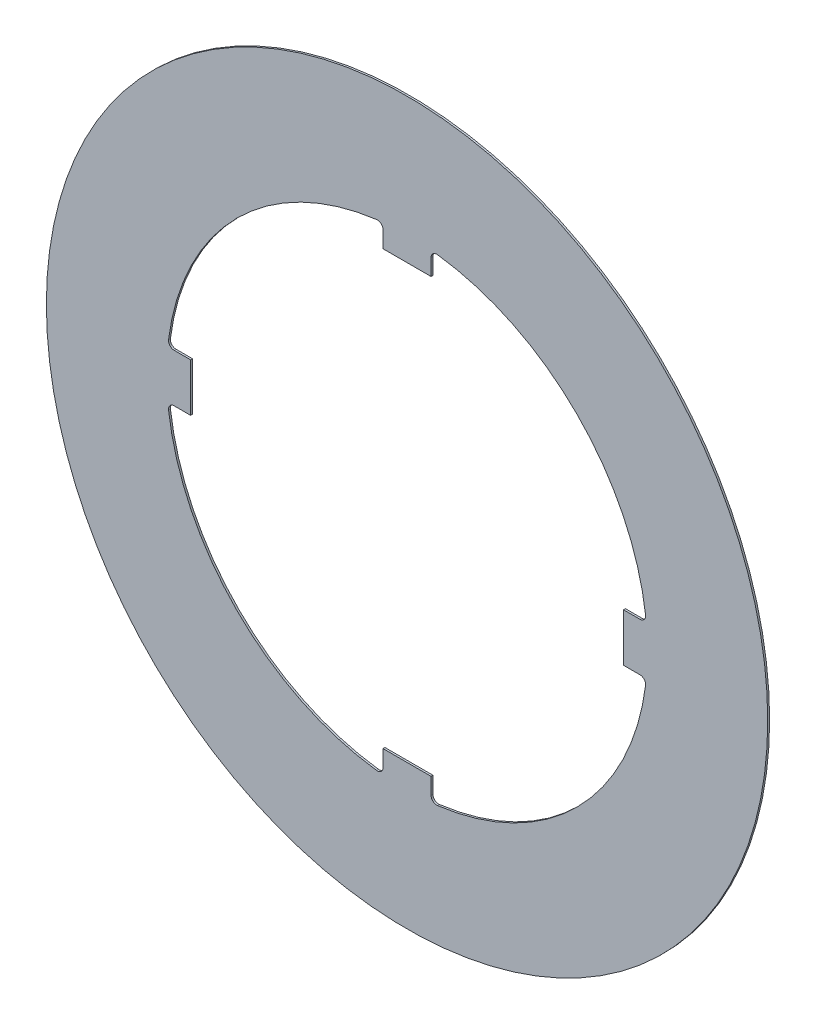
from build123d import *

# Parameters (mm, degrees)
SKETCH1_R           = 1905
BOSS_EXTRUDE1_DEPTH = 5


with BuildPart() as part:
    # Sketch1 → Boss-Extrude1 (new, symmetric)
    with BuildSketch(Plane.XY):
        Circle(SKETCH1_R)
        with BuildLine():
            ThreePointArc((160.798387097, -1259.779297618), (898.025612107, -898.025612107), (1259.779297618, -160.798387097))
            ThreePointArc((1259.779297618, -160.798387097), (1252.536854788, -137.175162206), (1230.020731533, -127))
            Line((1230.020731533, -127), (1143, -127))
            Line((1143, -127), (1143, 127))
            Line((1143, 127), (1230.020731533, 127))
            ThreePointArc((1230.020731533, 127), (1252.536854788, 137.175162206), (1259.779297618, 160.798387097))
            ThreePointArc((1259.779297618, 160.798387097), (898.025612107, 898.025612107), (160.798387097, 1259.779297618))
            ThreePointArc((160.798387097, 1259.779297618), (137.175162206, 1252.536854788), (127, 1230.020731533))
            Line((127, 1230.020731533), (127, 1143))
            Line((127, 1143), (-127, 1143))
            Line((-127, 1143), (-127, 1230.020731533))
            ThreePointArc((-127, 1230.020731533), (-137.175162206, 1252.536854788), (-160.798387097, 1259.779297618))
            ThreePointArc((-160.798387097, 1259.779297618), (-898.025612107, 898.025612107), (-1259.779297618, 160.798387097))
            ThreePointArc((-1259.779297618, 160.798387097), (-1252.536854788, 137.175162206), (-1230.020731533, 127))
            Line((-1230.020731533, 127), (-1143, 127))
            Line((-1143, 127), (-1143, -127))
            Line((-1143, -127), (-1230.020731533, -127))
            ThreePointArc((-1230.020731533, -127), (-1252.536854788, -137.175162206), (-1259.779297618, -160.798387097))
            ThreePointArc((-1259.779297618, -160.798387097), (-898.025612107, -898.025612107), (-160.798387097, -1259.779297618))
            ThreePointArc((-160.798387097, -1259.779297618), (-137.175162206, -1252.536854788), (-127, -1230.020731533))
            Line((-127, -1230.020731533), (-127, -1143))
            Line((-127, -1143), (127, -1143))
            Line((127, -1143), (127, -1230.020731533))
            ThreePointArc((127, -1230.020731533), (137.175162206, -1252.536854788), (160.798387097, -1259.779297618))
        make_face(mode=Mode.SUBTRACT)
    extrude(amount=BOSS_EXTRUDE1_DEPTH, both=True)


solid = part.part
